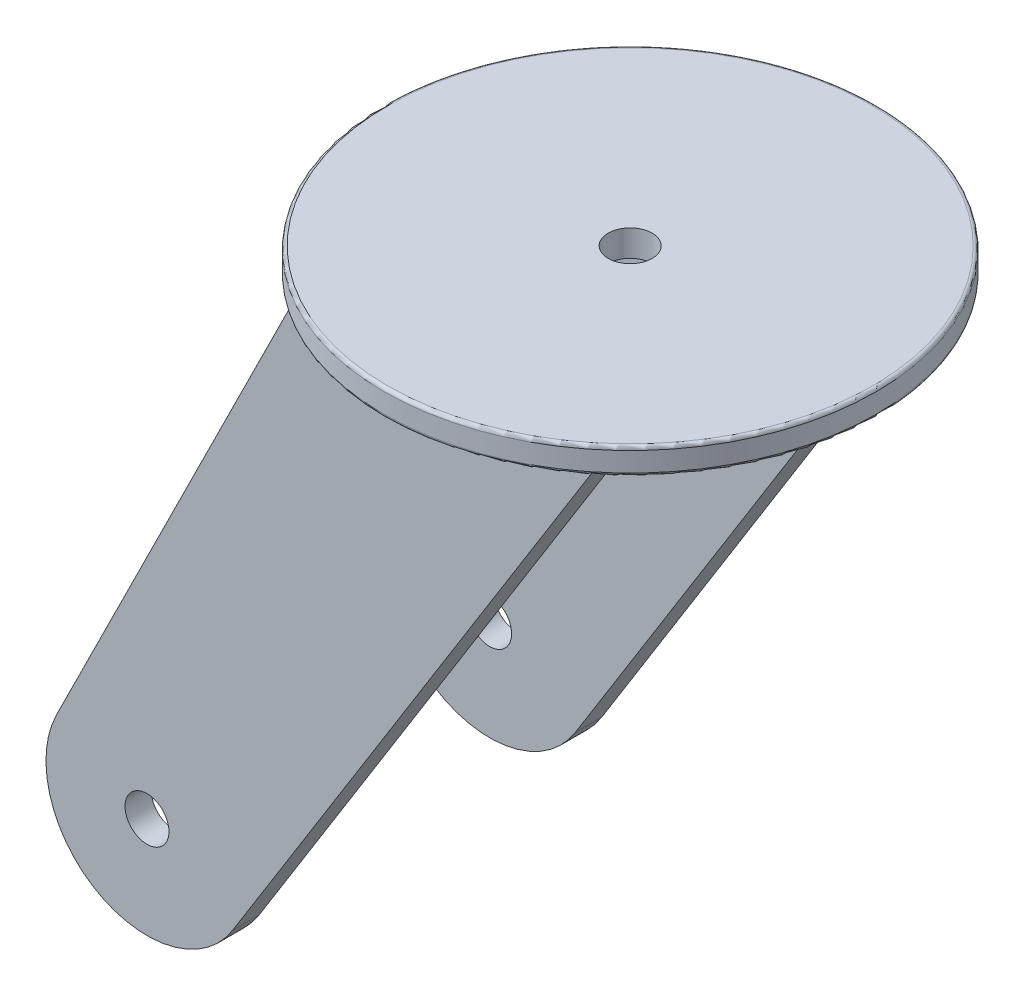
from build123d import *

# Parameters (mm, degrees)
SKETCH1_R           = 71.12
BOSS_EXTRUDE1_DEPTH = 7.62
FILLET1_R           = 0.9906
SKETCH3_R           = 6.35
BOSS_EXTRUDE2_DEPTH = 7.62
SKETCH5_R           = 6.35
CUT_EXTRUDE1_DEPTH  = 233.857192717


with BuildPart() as part:
    # Sketch1 → Boss-Extrude1 (new body)
    with BuildSketch(Plane(origin=(0, 0, 0), x_dir=(1, 0, 0), z_dir=(0, 1, 0))):
        with Locations(Location((0, 0, 0), (0, 0, 270))):
            Circle(SKETCH1_R)
    extrude(amount=BOSS_EXTRUDE1_DEPTH)

    # Fillet1
    fillet1_edges = [part.edges().sort_by_distance(p)[0] for p in [
        (0, 0, -71.12),
        (0, 7.62, -71.12),
    ]]
    fillet(fillet1_edges, radius=FILLET1_R)

    # Sketch3 → Boss-Extrude2 (add)
    with BuildSketch(Plane.XY.offset(45.72)):
        with BuildLine():
            Line((0, 0), (43.18, 0))
            Line((43.18, 0), (-61.579637217, -167.864725032))
            ThreePointArc((-61.579637217, -167.864725032), (-100.613254195, -177.896447691), (-112.513352174, -139.391300217))
            Line((-112.513352174, -139.391300217), (-43.18, 0))
            Line((-43.18, 0), (0, 0))
        make_face()
        with Locations((-86.36, -152.4)):
            Circle(SKETCH3_R, mode=Mode.SUBTRACT)
    boss_extrude2 = extrude(amount=BOSS_EXTRUDE2_DEPTH)

    # Mirror1: Boss-Extrude2 across plane
    add(boss_extrude2.mirror(Plane.XY))

    # Sketch5 → Cut-Extrude1 (cut, through all)
    with BuildSketch(Plane(origin=(0, 7.62, 0), x_dir=(1, 0, 0), z_dir=(0, 1, 0))):
        with Locations(Location((0, 0, 0), (0, 0, 270))):
            Circle(SKETCH5_R)
    extrude(amount=-CUT_EXTRUDE1_DEPTH, mode=Mode.SUBTRACT)


solid = part.part
